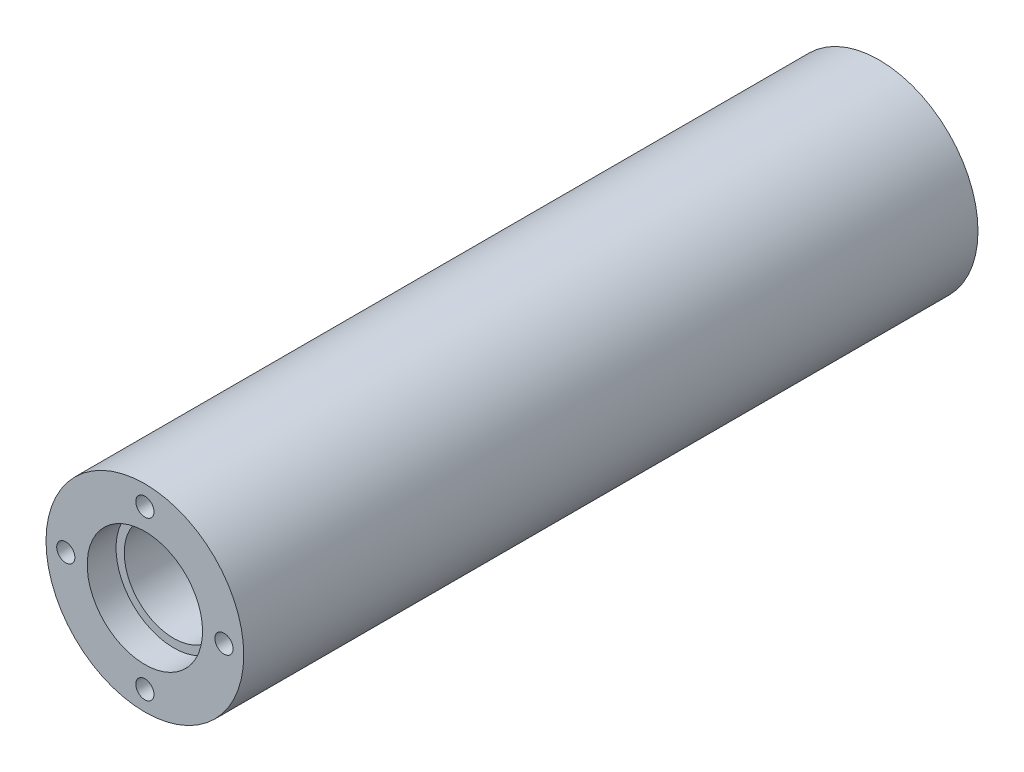
from build123d import *

# Parameters (mm, degrees)
SKETCH1_R           = 19.05
SKETCH1_R_2         = 9.525
BOSS_EXTRUDE1_DEPTH = 141.4653
SKETCH2_R           = 1.7526
CUT_EXTRUDE1_DEPTH  = 9.525
CUT_EXTRUDE2_START  = -9.525
SKETCH3_R           = 1.7526
CUT_EXTRUDE2_DEPTH  = 9.525
SKETCH6_R           = 11.1125
CUT_EXTRUDE3_DEPTH  = 5.55625
CUT_EXTRUDE4_START  = -5.55625
SKETCH7_R           = 11.1125
CUT_EXTRUDE4_DEPTH  = 5.55625


with BuildPart() as part:
    # Sketch1 → Boss-Extrude1 (new body)
    with BuildSketch(Plane.XY):
        with Locations(Location((0, 0, 0), (0, 0, 180))):
            Circle(SKETCH1_R)
        with Locations(Location((0, 0, 0), (0, 0, 180))):
            Circle(SKETCH1_R_2, mode=Mode.SUBTRACT)
    extrude(amount=BOSS_EXTRUDE1_DEPTH)

    # Sketch2 → Cut-Extrude1 (cut)
    with BuildSketch(Plane(origin=(0, 0, 0), x_dir=(-1, 0, 0), z_dir=(0, 0, -1))):
        with Locations((0, 15.24)):
            Circle(SKETCH2_R)
        with Locations((15.24, 0)):
            Circle(SKETCH2_R)
        with Locations((0, -15.24)):
            Circle(SKETCH2_R)
        with Locations((-15.24, 0)):
            Circle(SKETCH2_R)
    extrude(amount=-CUT_EXTRUDE1_DEPTH, mode=Mode.SUBTRACT)

    # Sketch3 → Cut-Extrude2 (cut)
    with BuildSketch(Plane.XY.offset(141.4653).offset(CUT_EXTRUDE2_START)):
        with Locations(Location((0, 15.24, 0), (0, 0, 180))):
            Circle(SKETCH3_R)
        with Locations(Location((15.24, 0, 0), (0, 0, 180))):
            Circle(SKETCH3_R)
        with Locations(Location((0, -15.24, 0), (0, 0, 180))):
            Circle(SKETCH3_R)
        with Locations(Location((-15.24, 0, 0), (0, 0, 180))):
            Circle(SKETCH3_R)
    extrude(amount=CUT_EXTRUDE2_DEPTH, mode=Mode.SUBTRACT)

    # Sketch6 → Cut-Extrude3 (cut)
    with BuildSketch(Plane.XY.offset(141.4653)):
        Circle(SKETCH6_R)
    extrude(amount=-CUT_EXTRUDE3_DEPTH, mode=Mode.SUBTRACT)

    # Sketch7 → Cut-Extrude4 (cut)
    with BuildSketch(Plane(origin=(0, 0, 0), x_dir=(-1, 0, 0), z_dir=(0, 0, -1)).offset(CUT_EXTRUDE4_START)):
        with Locations(Location((0, 0, 0), (0, 0, 180))):
            Circle(SKETCH7_R)
    extrude(amount=CUT_EXTRUDE4_DEPTH, mode=Mode.SUBTRACT)


solid = part.part
